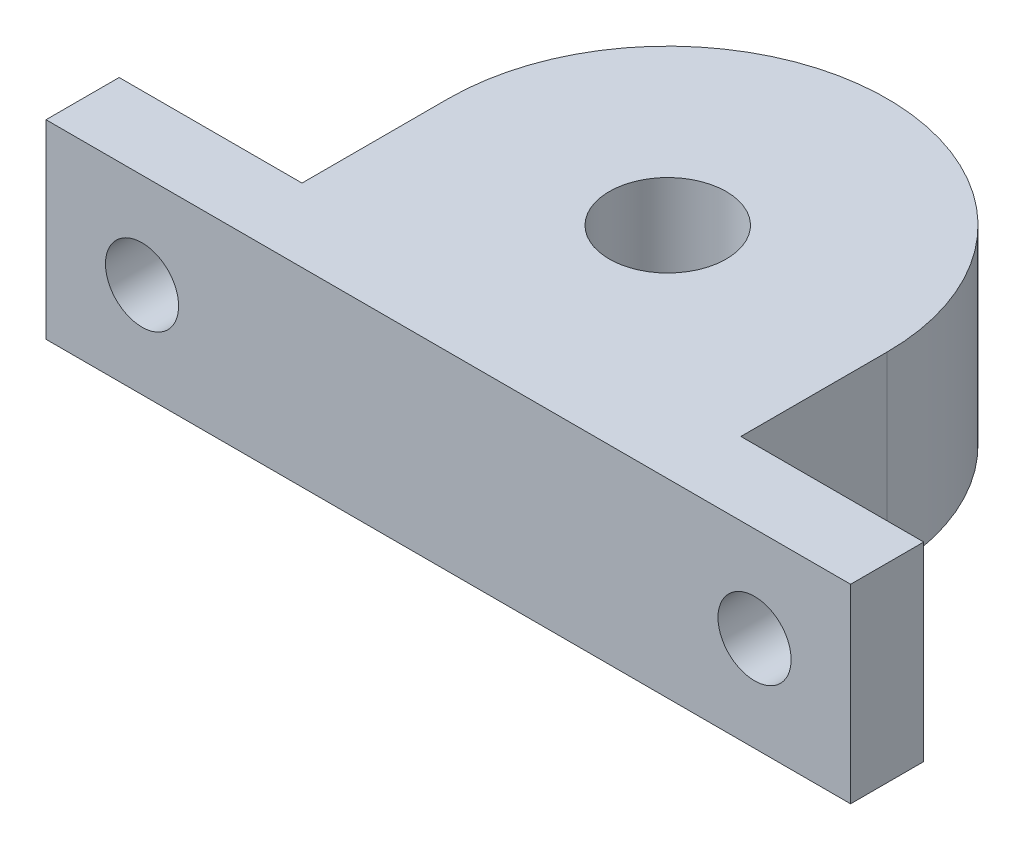
from build123d import *

# Parameters (mm, degrees)
SKETCH1_R            = 4
BOSS_EXTRUDE1_DEPTH  = 13
M4_CLEARANCE_HOLE1_D = 5


with BuildPart() as part:
    # Sketch1 → Boss-Extrude1 (new body)
    with BuildSketch(Plane(origin=(0, 0, 0), x_dir=(1, 0, 0), z_dir=(0, 1, 0))):
        with BuildLine():
            Line((-15, 0), (-15, -10))
            Line((-15, -10), (-27.5, -10))
            Line((-27.5, -10), (-27.5, -15))
            Line((-27.5, -15), (27.5, -15))
            Line((27.5, -15), (27.5, -10))
            Line((27.5, -10), (15, -10))
            Line((15, -10), (15, 0))
            ThreePointArc((15, 0), (0, 15), (-15, 0))
        make_face()
        with Locations(Location((0, 0, 0), (0, 0, 90))):
            Circle(SKETCH1_R, mode=Mode.SUBTRACT)
    extrude(amount=BOSS_EXTRUDE1_DEPTH)

    # M4 Clearance Hole1 (through all)
    with Locations(Plane(origin=(0, 0, 10), x_dir=(-1, 0, 0), z_dir=(0, 0, -1))):
        with Locations((-20.935, 6.5), (20.935, 6.5)):
            Hole(M4_CLEARANCE_HOLE1_D / 2)


solid = part.part
